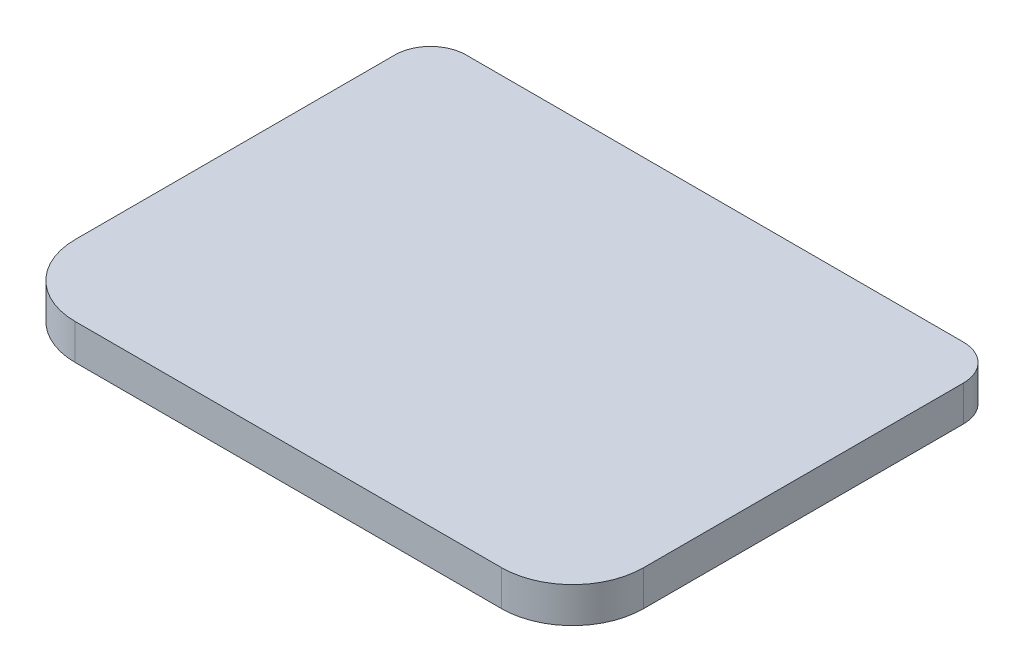
from build123d import *

# Parameters (mm, degrees)
SKETCH1_W           = 50.8
SKETCH1_H           = 38.1
BOSS_EXTRUDE1_DEPTH = 3.175
FILLET1_R           = 6.35
FILLET2_R           = 3.175


with BuildPart() as part:
    # Sketch1 → Boss-Extrude1 (new body)
    with BuildSketch(Plane(origin=(0, 0, 0), x_dir=(1, 0, 0), z_dir=(0, 1, 0))):
        Rectangle(SKETCH1_W, SKETCH1_H)
    extrude(amount=BOSS_EXTRUDE1_DEPTH)

    # Fillet1
    fillet1_edges = [part.edges().sort_by_distance(p)[0] for p in [
        (25.4, 1.5875, 19.05),
        (-25.4, 1.5875, 19.05),
    ]]
    fillet(fillet1_edges, radius=FILLET1_R)

    # Fillet2
    fillet2_edges = [part.edges().sort_by_distance(p)[0] for p in [
        (-25.4, 1.5875, -19.05),
        (25.4, 1.5875, -19.05),
    ]]
    fillet(fillet2_edges, radius=FILLET2_R)


solid = part.part
